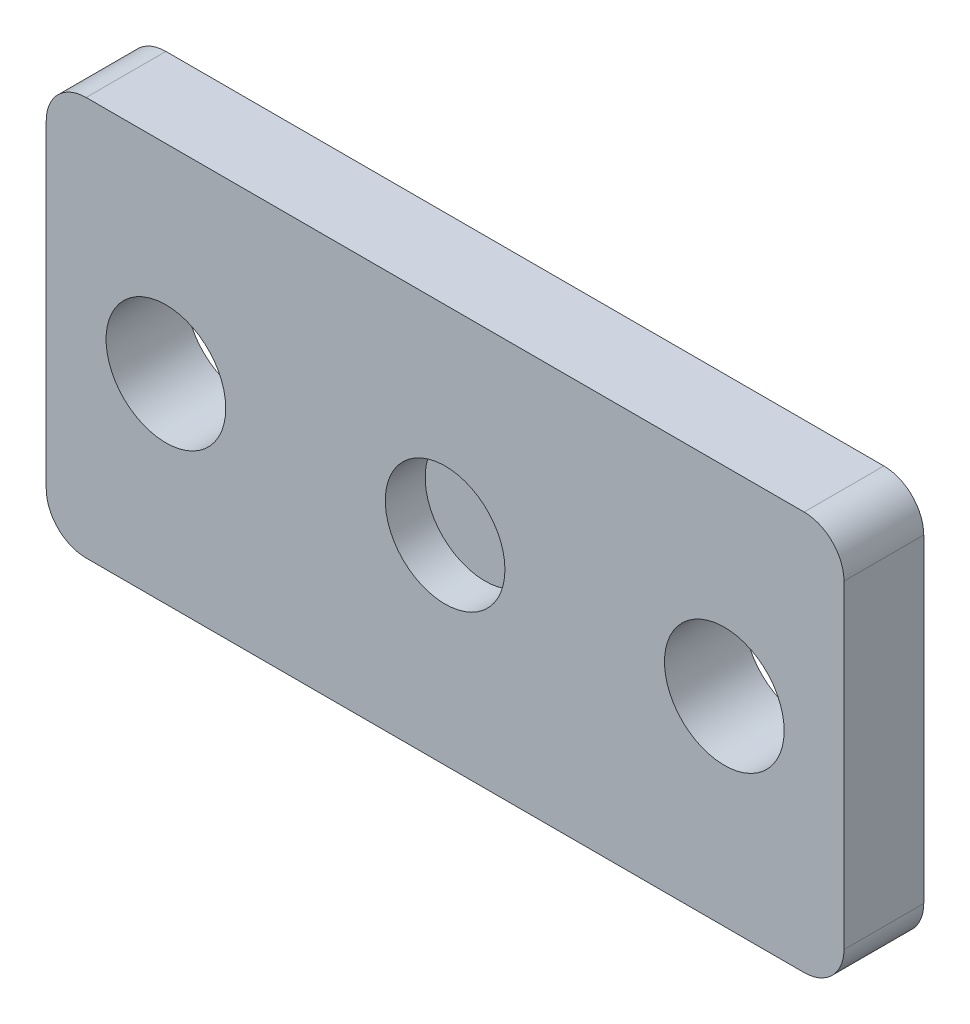
from build123d import *

# Parameters (mm, degrees)
SKETCH1_W           = 10000
SKETCH1_H           = 5000
BOSS_EXTRUDE1_DEPTH = 1000
FILLET1_R           = 500
FILLET2_R           = 500
SKETCH2_R           = 750
CUT_EXTRUDE1_DEPTH  = 5679.9083458
SKETCH3_R           = 750
CUT_EXTRUDE2_DEPTH  = 500
SKETCH4_W           = 2000
SKETCH4_H           = 2000
BOSS_EXTRUDE2_DEPTH = 500
FILLET3_R           = 250


with BuildPart() as part:
    # Sketch1 → Boss-Extrude1 (new body)
    with BuildSketch(Plane.XY):
        Rectangle(SKETCH1_W, SKETCH1_H)
    extrude(amount=BOSS_EXTRUDE1_DEPTH)

    # Fillet1
    fillet1_edges = [part.edges().sort_by_distance(p)[0] for p in [
        (-5000, 2500, 500),
    ]]
    fillet(fillet1_edges, radius=FILLET1_R)

    # Fillet2
    fillet2_edges = [part.edges().sort_by_distance(p)[0] for p in [
        (5000, -2500, 500),
        (-5000, -2500, 500),
        (5000, 2500, 500),
    ]]
    fillet(fillet2_edges, radius=FILLET2_R)

    # Sketch2 → Cut-Extrude1 (cut, through all)
    with BuildSketch(Plane.XY.offset(1000)):
        with Locations((-3500, 0)):
            Circle(SKETCH2_R)
        with Locations((3500, 0)):
            Circle(SKETCH2_R)
    extrude(amount=-CUT_EXTRUDE1_DEPTH, mode=Mode.SUBTRACT)

    # Sketch3 → Cut-Extrude2 (cut)
    with BuildSketch(Plane.XY.offset(1000)):
        Circle(SKETCH3_R)
    extrude(amount=-CUT_EXTRUDE2_DEPTH, mode=Mode.SUBTRACT)

    # Sketch4 → Boss-Extrude2 (add)
    with BuildSketch(Plane(origin=(0, 0, 0), x_dir=(-1, 0, 0), z_dir=(0, 0, -1))):
        Rectangle(SKETCH4_W, SKETCH4_H)
    extrude(amount=BOSS_EXTRUDE2_DEPTH)

    # Fillet3
    fillet3_edges = [part.edges().sort_by_distance(p)[0] for p in [
        (-1000, -1000, -250),
        (1000, 1000, -250),
        (1000, -1000, -250),
        (-1000, 0, -500),
        (0, 1000, -500),
        (1000, 0, -500),
        (0, -1000, -500),
    ]]
    fillet(fillet3_edges, radius=FILLET3_R)


solid = part.part
